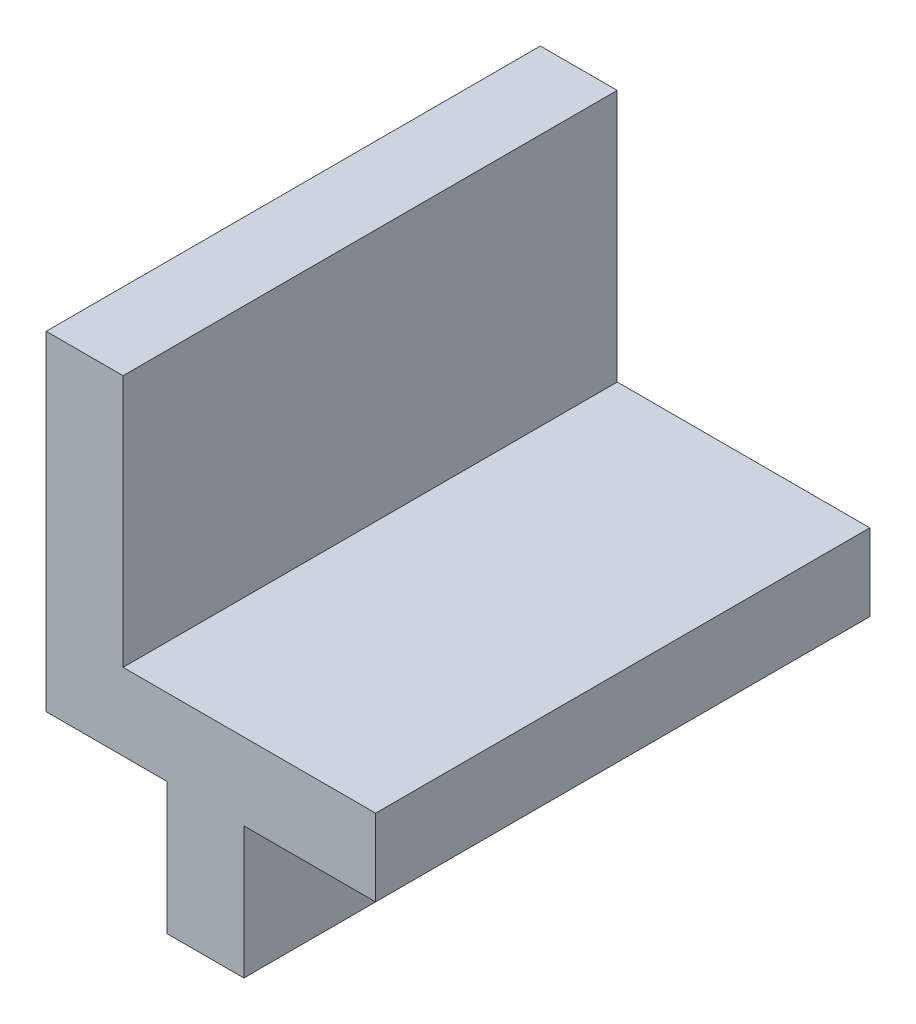
from build123d import *

# Parameters (mm, degrees)
EXTRUDE_1_DEPTH = 45
SKETCH_2_W      = 7
SKETCH_2_H      = 12
EXTRUDE_2_DEPTH = 45


with BuildPart() as part:
    # Эскиз1 → Бобышка-Вытянуть1 (new body)
    with BuildSketch(Plane.XY):
        Polygon((0, 0), (-30, 0), (-30, 30), (-23, 30), (-23, 7), (0, 7), align=None)
    extrude(amount=EXTRUDE_1_DEPTH)

    # Эскиз2 → Бобышка-Вытянуть2 (add)
    with BuildSketch(Plane.XY.offset(45)):
        with Locations((-15.5, -6)):
            Rectangle(SKETCH_2_W, SKETCH_2_H)
    extrude(amount=-EXTRUDE_2_DEPTH)


solid = part.part
